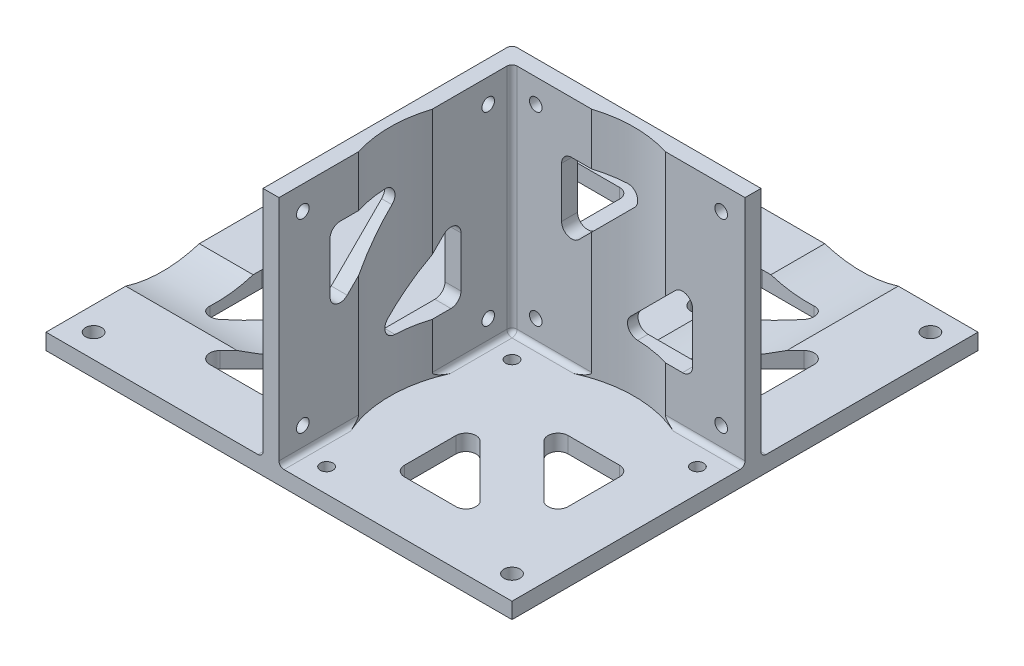
from build123d import *

# Parameters (mm, degrees)
SKETCH1_W                   = 92.5
SKETCH1_H                   = 92.5
SKETCH1_R                   = 1.6
BASE_PLATE_DEPTH            = 3.175
L_BRACKET_DEPTH             = 46.25
SKETCH3_R                   = 0.2
RW_HOLES_DEPTH              = 81.10734985
SKETCH7_R                   = 0.2
RW_HOLES_2_DEPTH            = 82.981434636
SKETCH8_R                   = 0.2
RW_HOLES_3_DEPTH            = 45
WR1_DEPTH                   = 45
WR2_DEPTH                   = 10
WR3_DEPTH                   = 10
FILLET1_R                   = 1
TAP_DRILL_FOR_M3X0_5_TAP1_D = 2.5
TAP_DRILL_FOR_M3X0_5_TAP2_D = 2.5
TAP_DRILL_FOR_M3X0_5_TAP3_D = 2.5
CUT_EXTRUDE1_REACH          = 83.981
SKETCH18_R                  = 24.25
CUT_EXTRUDE2_REACH          = 116.622
SKETCH19_R                  = 24.25
CUT_EXTRUDE3_REACH          = 116.622
SKETCH20_R                  = 24.25


with BuildPart() as part:
    # Sketch1 → Base Plate (new body)
    with BuildSketch(Plane(origin=(0, 0, 0), x_dir=(1, 0, 0), z_dir=(0, 1, 0))):
        Rectangle(SKETCH1_W, SKETCH1_H)
        with Locations(Location((-41.525, -41.525, 0), (0, 0, 270))):
            Circle(SKETCH1_R, mode=Mode.SUBTRACT)
        with Locations(Location((-41.525, 41.525, 0), (0, 0, 270))):
            Circle(SKETCH1_R, mode=Mode.SUBTRACT)
        with Locations(Location((41.525, 41.525, 0), (0, 0, 270))):
            Circle(SKETCH1_R, mode=Mode.SUBTRACT)
        with Locations(Location((41.525, -41.525, 0), (0, 0, 270))):
            Circle(SKETCH1_R, mode=Mode.SUBTRACT)
    extrude(amount=BASE_PLATE_DEPTH)

    # Sketch2 → L-Bracket (add)
    with BuildSketch(Plane(origin=(0, 3.175, 0), x_dir=(1, 0, 0), z_dir=(0, 1, 0))):
        Polygon((0, 0), (46.25, 0), (46.25, 3.175), (-3.175, 3.175), (-3.175, -46.25), (0, -46.25), align=None)
    extrude(amount=L_BRACKET_DEPTH)

    # Sketch3 → RW Holes (cut, through all)
    with BuildSketch(Plane(origin=(0, 3.175, 0), x_dir=(1, 0, 0), z_dir=(0, 1, 0))):
        with Locations(Location((41.525, -4.725, 0), (0, 0, 270))):
            Circle(SKETCH3_R)
        with Locations(Location((4.725, -4.725, 0), (0, 0, 270))):
            Circle(SKETCH3_R)
        with Locations(Location((4.725, -41.525, 0), (0, 0, 270))):
            Circle(SKETCH3_R)
    extrude(amount=-RW_HOLES_DEPTH, mode=Mode.SUBTRACT)

    # Sketch7 → RW Holes 2 (cut, through all)
    with BuildSketch(Plane.XY):
        with Locations((41.525, 7.9)):
            Circle(SKETCH7_R)
        with Locations((4.725, 7.9)):
            Circle(SKETCH7_R)
        with Locations((4.725, 44.7)):
            Circle(SKETCH7_R)
        with Locations((41.525, 44.7)):
            Circle(SKETCH7_R)
    extrude(amount=-RW_HOLES_2_DEPTH, mode=Mode.SUBTRACT)

    # Sketch8 → RW Holes 3 (cut)
    with BuildSketch(Plane(origin=(0, 0, 0), x_dir=(0, 0, -1), z_dir=(1, 0, 0))):
        with Locations((-41.525, 7.9)):
            Circle(SKETCH8_R)
        with Locations((-41.525, 44.7)):
            Circle(SKETCH8_R)
        with Locations((-4.725, 44.7)):
            Circle(SKETCH8_R)
        with Locations((-4.725, 7.9)):
            Circle(SKETCH8_R)
    extrude(amount=-RW_HOLES_3_DEPTH, mode=Mode.SUBTRACT)

    # Sketch10 → WR1 (cut)
    with BuildSketch(Plane.XZ):
        with BuildLine():
            Line((21.929098618, 15.613273342), (32.144747922, 25.828922646))
            ThreePointArc((32.144747922, 25.828922646), (34.324328349, 26.262468149), (35.558961485, 24.414709084))
            Line((35.558961485, 24.414709084), (35.558961485, 14.199059779))
            ThreePointArc((35.558961485, 14.199059779), (34.973175047, 12.784846217), (33.558961485, 12.199059779))
            Line((33.558961485, 12.199059779), (23.34331218, 12.199059779))
            ThreePointArc((23.34331218, 12.199059779), (21.495553115, 13.433692915), (21.929098618, 15.613273342))
        make_face()
        with BuildLine():
            Line((24.414709084, 35.558961485), (14.199059779, 35.558961485))
            ThreePointArc((14.199059779, 35.558961485), (12.784846217, 34.973175047), (12.199059779, 33.558961485))
            Line((12.199059779, 33.558961485), (12.199059779, 23.34331218))
            ThreePointArc((12.199059779, 23.34331218), (13.433692915, 21.495553115), (15.613273342, 21.929098618))
            Line((15.613273342, 21.929098618), (25.828922646, 32.144747922))
            ThreePointArc((25.828922646, 32.144747922), (26.262468149, 34.324328349), (24.414709084, 35.558961485))
        make_face()
        with BuildLine():
            Line((35.558961485, -24.414709084), (35.558961485, -14.199059779))
            ThreePointArc((35.558961485, -14.199059779), (34.973175047, -12.784846217), (33.558961485, -12.199059779))
            Line((33.558961485, -12.199059779), (23.34331218, -12.199059779))
            ThreePointArc((23.34331218, -12.199059779), (21.495553115, -13.433692915), (21.929098618, -15.613273342))
            Line((21.929098618, -15.613273342), (32.144747922, -25.828922646))
            ThreePointArc((32.144747922, -25.828922646), (34.324328349, -26.262468149), (35.558961485, -24.414709084))
        make_face()
        with BuildLine():
            Line((12.199059779, -33.558961485), (12.199059779, -23.34331218))
            ThreePointArc((12.199059779, -23.34331218), (13.433692915, -21.495553115), (15.613273342, -21.929098618))
            Line((15.613273342, -21.929098618), (25.828922646, -32.144747922))
            ThreePointArc((25.828922646, -32.144747922), (26.262468149, -34.324328349), (24.414709084, -35.558961485))
            Line((24.414709084, -35.558961485), (14.199059779, -35.558961485))
            ThreePointArc((14.199059779, -35.558961485), (12.784846217, -34.973175047), (12.199059779, -33.558961485))
        make_face()
        with BuildLine():
            Line((-24.414709084, -35.558961485), (-14.199059779, -35.558961485))
            ThreePointArc((-14.199059779, -35.558961485), (-12.784846217, -34.973175047), (-12.199059779, -33.558961485))
            Line((-12.199059779, -33.558961485), (-12.199059779, -23.34331218))
            ThreePointArc((-12.199059779, -23.34331218), (-13.433692915, -21.495553115), (-15.613273342, -21.929098618))
            Line((-15.613273342, -21.929098618), (-25.828922646, -32.144747922))
            ThreePointArc((-25.828922646, -32.144747922), (-26.262468149, -34.324328349), (-24.414709084, -35.558961485))
        make_face()
        with BuildLine():
            Line((-33.558961485, -12.199059779), (-23.34331218, -12.199059779))
            ThreePointArc((-23.34331218, -12.199059779), (-21.495553115, -13.433692915), (-21.929098618, -15.613273342))
            Line((-21.929098618, -15.613273342), (-32.144747922, -25.828922646))
            ThreePointArc((-32.144747922, -25.828922646), (-34.324328349, -26.262468149), (-35.558961485, -24.414709084))
            Line((-35.558961485, -24.414709084), (-35.558961485, -14.199059779))
            ThreePointArc((-35.558961485, -14.199059779), (-34.973175047, -12.784846217), (-33.558961485, -12.199059779))
        make_face()
        with BuildLine():
            Line((-35.558961485, 24.414709084), (-35.558961485, 14.199059779))
            ThreePointArc((-35.558961485, 14.199059779), (-34.973175047, 12.784846217), (-33.558961485, 12.199059779))
            Line((-33.558961485, 12.199059779), (-23.34331218, 12.199059779))
            ThreePointArc((-23.34331218, 12.199059779), (-21.495553115, 13.433692915), (-21.929098618, 15.613273342))
            Line((-21.929098618, 15.613273342), (-32.144747922, 25.828922646))
            ThreePointArc((-32.144747922, 25.828922646), (-34.324328349, 26.262468149), (-35.558961485, 24.414709084))
        make_face()
        with BuildLine():
            Line((-12.199059779, 33.558961485), (-12.199059779, 23.34331218))
            ThreePointArc((-12.199059779, 23.34331218), (-13.433692915, 21.495553115), (-15.613273342, 21.929098618))
            Line((-15.613273342, 21.929098618), (-25.828922646, 32.144747922))
            ThreePointArc((-25.828922646, 32.144747922), (-26.262468149, 34.324328349), (-24.414709084, 35.558961485))
            Line((-24.414709084, 35.558961485), (-14.199059779, 35.558961485))
            ThreePointArc((-14.199059779, 35.558961485), (-12.784846217, 34.973175047), (-12.199059779, 33.558961485))
        make_face()
    extrude(amount=-WR1_DEPTH, mode=Mode.SUBTRACT)

    # Sketch11 → WR2 (cut)
    with BuildSketch(Plane(origin=(0, 0, 0), x_dir=(0, 0, -1), z_dir=(1, 0, 0))):
        with BuildLine():
            Line((-36.12416823, 37.29916823), (-36.12416823, 27.293939508))
            ThreePointArc((-36.12416823, 27.293939508), (-34.889535095, 25.446180442), (-32.709954668, 25.879725945))
            Line((-32.709954668, 25.879725945), (-22.704725945, 35.884954668))
            ThreePointArc((-22.704725945, 35.884954668), (-22.271180442, 38.064535095), (-24.118939508, 39.29916823))
            Line((-24.118939508, 39.29916823), (-34.12416823, 39.29916823))
            ThreePointArc((-34.12416823, 39.29916823), (-35.538381793, 38.713381793), (-36.12416823, 37.29916823))
        make_face()
        with BuildLine():
            Line((-10.12583177, 15.30083177), (-10.12583177, 25.306060492))
            ThreePointArc((-10.12583177, 25.306060492), (-11.360464905, 27.153819558), (-13.540045332, 26.720274055))
            Line((-13.540045332, 26.720274055), (-23.545274055, 16.715045332))
            ThreePointArc((-23.545274055, 16.715045332), (-23.978819558, 14.535464905), (-22.131060492, 13.30083177))
            Line((-22.131060492, 13.30083177), (-12.12583177, 13.30083177))
            ThreePointArc((-12.12583177, 13.30083177), (-10.711618207, 13.886618207), (-10.12583177, 15.30083177))
        make_face()
    extrude(amount=-WR2_DEPTH, mode=Mode.SUBTRACT)

    # Sketch12 → WR3 (cut)
    with BuildSketch(Plane.XY):
        with BuildLine():
            Line((9.839910874, 37.129651873), (9.839910874, 27.124423151))
            ThreePointArc((9.839910874, 27.124423151), (11.074544009, 25.276664086), (13.254124437, 25.710209588))
            Line((13.254124437, 25.710209588), (23.259353159, 35.715438311))
            ThreePointArc((23.259353159, 35.715438311), (23.692898662, 37.895018738), (21.845139597, 39.129651873))
            Line((21.845139597, 39.129651873), (11.839910874, 39.129651873))
            ThreePointArc((11.839910874, 39.129651873), (10.425697312, 38.543865436), (9.839910874, 37.129651873))
        make_face()
        with BuildLine():
            Line((35.838247335, 15.131315413), (35.838247335, 25.136544136))
            ThreePointArc((35.838247335, 25.136544136), (34.6036142, 26.984303201), (32.424033772, 26.550757698))
            Line((32.424033772, 26.550757698), (22.41880505, 16.545528975))
            ThreePointArc((22.41880505, 16.545528975), (21.985259547, 14.365948548), (23.833018612, 13.131315413))
            Line((23.833018612, 13.131315413), (33.838247335, 13.131315413))
            ThreePointArc((33.838247335, 13.131315413), (35.252460897, 13.71710185), (35.838247335, 15.131315413))
        make_face()
    extrude(amount=-WR3_DEPTH, mode=Mode.SUBTRACT)

    # Fillet1
    fillet1_edges = [part.edges().sort_by_distance(p)[0] for p in [
        (0, 3.175, 23.125),
        (23.125, 3.175, 0),
        (0, 26.3, 0),
        (21.5375, 3.175, -3.175),
        (-3.175, 3.175, 21.5375),
        (-3.175, 26.3, -3.175),
    ]]
    fillet(fillet1_edges, radius=FILLET1_R)

    # Tap Drill for M3x0.5 Tap1 (through all)
    with Locations(Plane(origin=(41.525, 3.175, 4.725), x_dir=(0, 0, 1), z_dir=(0, 1, 0))):
        with Locations((0, 0), (0, -36.8), (36.8, -36.8)):
            Hole(TAP_DRILL_FOR_M3X0_5_TAP1_D / 2)

    # Tap Drill for M3x0.5 Tap2 (through all)
    with Locations(Plane(origin=(41.525, 44.7, 0), x_dir=(1, 0, 0), z_dir=(0, 0, 1))):
        with Locations((0, 0), (0, -36.8), (-36.8, -36.8), (-36.8, 0)):
            Hole(TAP_DRILL_FOR_M3X0_5_TAP2_D / 2)

    # Tap Drill for M3x0.5 Tap3 (through all)
    with Locations(Plane(origin=(-3.175, 44.7, 4.725), x_dir=(0, 0, -1), z_dir=(-1, 0, 0))):
        with Locations((0, 0), (-36.8, 0), (-36.8, 36.8), (0, 36.8)):
            Hole(TAP_DRILL_FOR_M3X0_5_TAP3_D / 2)

    # Cut-Extrude1: up to this face of the body (flat: up to its plane)
    cut_extrude1_end = Plane(part.part.faces().sort_by_distance((23.559726289, 3.175, 23.559726289))[0])
    # Sketch18 → Cut-Extrude1 (cut, up to the picked face)
    with BuildSketch(Plane(origin=(0, 49.425, 0), x_dir=(1, 0, 0), z_dir=(0, 1, 0)), mode=Mode.PRIVATE) as cut_extrude1_sk1:
        with Locations((23.125, -23.125)):
            Circle(SKETCH18_R)
    cut_extrude1_tool1 = split(extrude(cut_extrude1_sk1.sketch, amount=-CUT_EXTRUDE1_REACH, mode=Mode.PRIVATE), bisect_by=cut_extrude1_end, keep=Keep.BOTH, mode=Mode.PRIVATE)
    add(cut_extrude1_tool1.solids().sort_by(Axis((23.125, 49.425, 23.125), (0, -1, 0)))[0], mode=Mode.SUBTRACT)

    # Cut-Extrude2: up to this face of the body (flat: up to its plane)
    cut_extrude2_end = Plane(part.part.faces().sort_by_distance((21.916399263, 26.896950708, -3.175))[0])
    # Sketch19 → Cut-Extrude2 (cut, up to the picked face)
    with BuildSketch(Plane(origin=(0, 0, -46.25), x_dir=(-1, 0, 0), z_dir=(0, 0, -1)), mode=Mode.PRIVATE) as cut_extrude2_sk1:
        with Locations((-23.125, 26.3)):
            Circle(SKETCH19_R)
    cut_extrude2_tool1 = split(extrude(cut_extrude2_sk1.sketch, amount=-CUT_EXTRUDE2_REACH, mode=Mode.PRIVATE), bisect_by=cut_extrude2_end, keep=Keep.BOTH, mode=Mode.PRIVATE)
    add(cut_extrude2_tool1.solids().sort_by(Axis((23.125, 26.3, -46.25), (0, 0, 1)))[0], mode=Mode.SUBTRACT)

    # Cut-Extrude3: up to this face of the body (flat: up to its plane)
    cut_extrude3_end = Plane(part.part.faces().sort_by_distance((-3.175, 26.873705149, 21.877191301))[0])
    # Sketch20 → Cut-Extrude3 (cut, up to the picked face)
    with BuildSketch(Plane.ZY.offset(46.25), mode=Mode.PRIVATE) as cut_extrude3_sk1:
        with Locations((23.125, 26.3)):
            Circle(SKETCH20_R)
    cut_extrude3_tool1 = split(extrude(cut_extrude3_sk1.sketch, amount=-CUT_EXTRUDE3_REACH, mode=Mode.PRIVATE), bisect_by=cut_extrude3_end, keep=Keep.BOTH, mode=Mode.PRIVATE)
    add(cut_extrude3_tool1.solids().sort_by(Axis((-46.25, 26.3, 23.125), (1, 0, 0)))[0], mode=Mode.SUBTRACT)


solid = part.part
